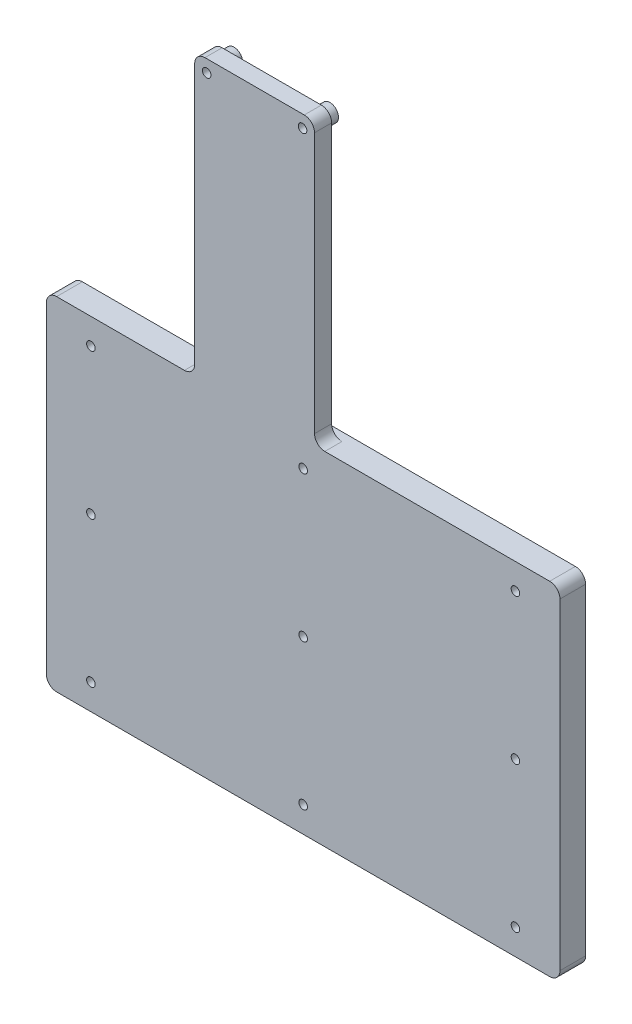
from build123d import *

# Parameters (mm, degrees)
ESQUISSE1_R             = 1.25
BOSS_EXTRU_1_DEPTH      = 8
ESQUISSE5_W             = 45.3176151
ESQUISSE5_H             = 84.101601091
ESQUISSE5_R             = 2.5
ENL_V_MAT_EXTRU_2_DEPTH = 3
ESQUISSE6_W             = 5
ESQUISSE6_H             = 62
BOSS_DC_DC_DEPTH        = 2
ENL_V_INDUCTORS_DEPTH   = 2
ESQUISSE8_W             = 154.760825025
ESQUISSE8_H             = 103.254487946
ENL_V_MAT_EXTRU_3_DEPTH = 0.5


with BuildPart() as part:
    # Esquisse1 → Boss.-Extru.1 (new body)
    with BuildSketch(Plane.XY):
        with BuildLine():
            Line((43.290045774, 103.030192742), (43.290045774, 179.130192742))
            ThreePointArc((43.290045774, 179.130192742), (44.16872543, 181.251513085), (46.290045774, 182.130192742))
            Line((46.290045774, 182.130192742), (75.290045774, 182.130192742))
            ThreePointArc((75.290045774, 182.130192742), (77.411366118, 181.251513085), (78.290045774, 179.130192742))
            Line((78.290045774, 179.130192742), (78.290045774, 103.030192742))
            ThreePointArc((78.290045774, 103.030192742), (79.16872543, 100.908872398), (81.290045774, 100.030192742))
            Line((81.290045774, 100.030192742), (146.96841177, 100.030192742))
            ThreePointArc((146.96841177, 100.030192742), (149.089732114, 99.151513085), (149.96841177, 97.030192742))
            Line((149.96841177, 97.030192742), (149.96841177, 3.030192742))
            ThreePointArc((149.96841177, 3.030192742), (149.089732114, 0.908872398), (146.96841177, 0.030192742))
            Line((146.96841177, 0.030192742), (2.96841177, 0.030192742))
            ThreePointArc((2.96841177, 0.030192742), (0.847091427, 0.908872398), (-0.03158823, 3.030192742))
            Line((-0.03158823, 3.030192742), (-0.03158823, 97.030192742))
            ThreePointArc((-0.03158823, 97.030192742), (0.847091427, 99.151513085), (2.96841177, 100.030192742))
            Line((2.96841177, 100.030192742), (40.290045774, 100.030192742))
            ThreePointArc((40.290045774, 100.030192742), (42.411366118, 100.908872398), (43.290045774, 103.030192742))
        make_face()
        with Locations((12.96841177, 92.530192742)):
            Circle(ESQUISSE1_R, mode=Mode.SUBTRACT)
        with Locations((74.96841177, 92.530192742)):
            Circle(ESQUISSE1_R, mode=Mode.SUBTRACT)
        with Locations((136.96841177, 92.530192742)):
            Circle(ESQUISSE1_R, mode=Mode.SUBTRACT)
        with Locations((12.96841177, 50.030192742)):
            Circle(ESQUISSE1_R, mode=Mode.SUBTRACT)
        with Locations((74.96841177, 50.030192742)):
            Circle(ESQUISSE1_R, mode=Mode.SUBTRACT)
        with Locations((136.96841177, 50.030192742)):
            Circle(ESQUISSE1_R, mode=Mode.SUBTRACT)
        with Locations((136.96841177, 7.530192742)):
            Circle(ESQUISSE1_R, mode=Mode.SUBTRACT)
        with Locations((74.96841177, 7.530192742)):
            Circle(ESQUISSE1_R, mode=Mode.SUBTRACT)
        with Locations((12.96841177, 7.530192742)):
            Circle(ESQUISSE1_R, mode=Mode.SUBTRACT)
        with Locations((46.790045774, 178.530192742)):
            Circle(ESQUISSE1_R, mode=Mode.SUBTRACT)
        with Locations((74.790045774, 178.530192742)):
            Circle(ESQUISSE1_R, mode=Mode.SUBTRACT)
    extrude(amount=BOSS_EXTRU_1_DEPTH)

    # Esquisse5 → Enlèv. mat.-Extru.2 (cut)
    with BuildSketch(Plane(origin=(0, 0, 0), x_dir=(-1, 0, 0), z_dir=(0, 0, -1))):
        with Locations((-61.04710063, 142.080993288)):
            Rectangle(ESQUISSE5_W, ESQUISSE5_H)
        with Locations((-74.790045774, 178.530192742)):
            Circle(ESQUISSE5_R, mode=Mode.SUBTRACT)
        with Locations((-46.790045774, 178.530192742)):
            Circle(ESQUISSE5_R, mode=Mode.SUBTRACT)
    extrude(amount=-ENL_V_MAT_EXTRU_2_DEPTH, mode=Mode.SUBTRACT)

    # Esquisse6 → Boss.-DC/DC (add)
    with BuildSketch(Plane(origin=(0, 0, 3), x_dir=(-1, 0, 0), z_dir=(0, 0, -1))):
        with Locations((-53.290045774, 134.530192742)):
            Rectangle(ESQUISSE6_W, ESQUISSE6_H)
    extrude(amount=BOSS_DC_DC_DEPTH)

    # Esquisse7 → Enlèv. Inductors (cut)
    with BuildSketch(Plane(origin=(0, 0, 3), x_dir=(-1, 0, 0), z_dir=(0, 0, -1))):
        with BuildLine():
            Line((-73.790045774, 167.530192742), (-65.790045774, 167.530192742))
            ThreePointArc((-65.790045774, 167.530192742), (-64.375832212, 166.944406304), (-63.790045774, 165.530192742))
            Line((-63.790045774, 165.530192742), (-63.790045774, 107.530192742))
            ThreePointArc((-63.790045774, 107.530192742), (-64.375832212, 106.115979179), (-65.790045774, 105.530192742))
            Line((-65.790045774, 105.530192742), (-73.790045774, 105.530192742))
            ThreePointArc((-73.790045774, 105.530192742), (-75.204259336, 106.115979179), (-75.790045774, 107.530192742))
            Line((-75.790045774, 107.530192742), (-75.790045774, 165.530192742))
            ThreePointArc((-75.790045774, 165.530192742), (-75.204259336, 166.944406304), (-73.790045774, 167.530192742))
        make_face()
    extrude(amount=-ENL_V_INDUCTORS_DEPTH, mode=Mode.SUBTRACT)

    # Esquisse8 → Enlèv. mat.-Extru.3 (cut)
    with BuildSketch(Plane(origin=(0, 0, 0), x_dir=(-1, 0, 0), z_dir=(0, 0, -1))):
        with Locations((-74.96841177, 50.092755489)):
            Rectangle(ESQUISSE8_W, ESQUISSE8_H)
    extrude(amount=-ENL_V_MAT_EXTRU_3_DEPTH, mode=Mode.SUBTRACT)


solid = part.part
